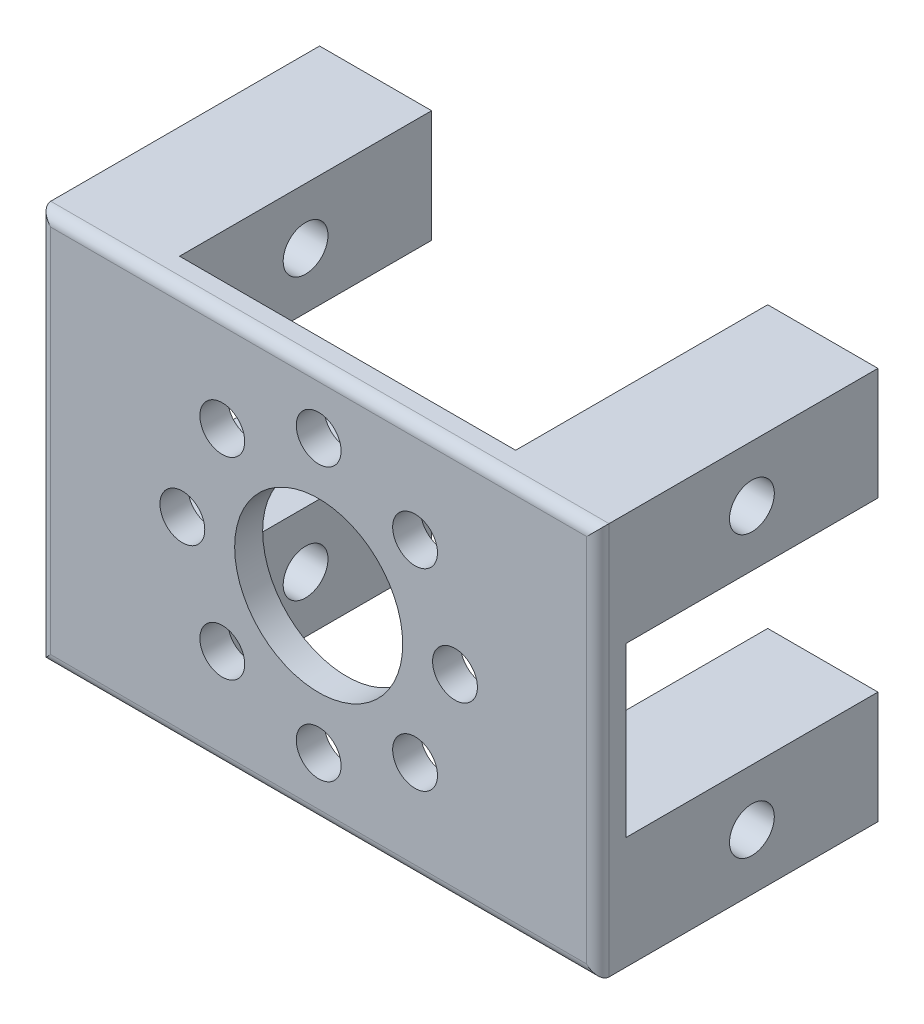
from build123d import *

# Parameters (mm, degrees)
ESBO_O1_W                  = 99.678448554
ESBO_O1_H                  = 70.090169096
ESBO_O1_R                  = 15
ESBO_O1_R_2                = 4
RESSALTO_EXTRUS_O1_DEPTH   = 50
CORTE_EXTRUS_O1_DEPTH      = 79.816915872
CORTE_EXTRUS_O1_DEPTH_BACK = 79.816915872
ESBO_O2_W                  = 60
ESBO_O2_H                  = 45
CORTE_EXTRUS_O2_DEPTH      = 79.816915872
CORTE_EXTRUS_O2_DEPTH_BACK = 79.816915872
CORTE_EXTRUS_O4_DEPTH      = 79.816915872
CORTE_EXTRUS_O4_DEPTH_BACK = 79.816915872
ESBO_O4_R                  = 4
FILETE4_R                  = 2


with BuildPart() as part:
    # Esboço1 → Ressalto-extrusão1 (new body)
    with BuildSketch(Plane.XY):
        Rectangle(ESBO_O1_W, ESBO_O1_H)
        Circle(ESBO_O1_R, mode=Mode.SUBTRACT)
        with Locations((24.33507008, 0)):
            Circle(ESBO_O1_R_2, mode=Mode.SUBTRACT)
        with Locations((17.207493074, -17.207493074)):
            Circle(ESBO_O1_R_2, mode=Mode.SUBTRACT)
        with Locations((0, -24.33507008)):
            Circle(ESBO_O1_R_2, mode=Mode.SUBTRACT)
        with Locations((-17.207493074, -17.207493074)):
            Circle(ESBO_O1_R_2, mode=Mode.SUBTRACT)
        with Locations((-24.33507008, 0)):
            Circle(ESBO_O1_R_2, mode=Mode.SUBTRACT)
        with Locations((-17.207493074, 17.207493074)):
            Circle(ESBO_O1_R_2, mode=Mode.SUBTRACT)
        with Locations((0, 24.33507008)):
            Circle(ESBO_O1_R_2, mode=Mode.SUBTRACT)
        with Locations((17.207493074, 17.207493074)):
            Circle(ESBO_O1_R_2, mode=Mode.SUBTRACT)
    extrude(amount=RESSALTO_EXTRUS_O1_DEPTH)

    # Esboço2 → Corte-extrusão1 (cut, two sides: drawn at the far end of the back side and taken through both)
    with BuildSketch(Plane(origin=(0, 0, 0), x_dir=(1, 0, 0), z_dir=(0, 1, 0)).offset(-CORTE_EXTRUS_O1_DEPTH_BACK)):
        with Locations((0.160775723, -22.5)):
            Rectangle(ESBO_O2_W, ESBO_O2_H)
    extrude(amount=CORTE_EXTRUS_O1_DEPTH + CORTE_EXTRUS_O1_DEPTH_BACK, mode=Mode.SUBTRACT)

    # Esboço3 → Corte-extrusão2 (cut, two sides: drawn at the far end of the back side and taken through both)
    with BuildSketch(Plane(origin=(0, 0, 0), x_dir=(0, 0, -1), z_dir=(1, 0, 0)).offset(-CORTE_EXTRUS_O2_DEPTH_BACK)):
        Polygon((0, 0), (0, 15), (-45, 15), (-45, -15), (0, -15), align=None)
    extrude(amount=CORTE_EXTRUS_O2_DEPTH + CORTE_EXTRUS_O2_DEPTH_BACK, mode=Mode.SUBTRACT)

    # Esboço4 → Corte-extrusão4 (cut, two sides: drawn at the far end of the back side and taken through both)
    with BuildSketch(Plane(origin=(0, 0, 0), x_dir=(0, 0, -1), z_dir=(1, 0, 0)).offset(-CORTE_EXTRUS_O4_DEPTH_BACK)):
        with Locations((-22.5, -25.022542274)):
            Circle(ESBO_O4_R)
        with Locations(Location((-22.5, 25.022542274, 0), (0, 0, 180))):
            Circle(ESBO_O4_R)
    extrude(amount=CORTE_EXTRUS_O4_DEPTH + CORTE_EXTRUS_O4_DEPTH_BACK, mode=Mode.SUBTRACT)

    # Filete4
    filete4_edges = [part.edges().sort_by_distance(p)[0] for p in [
        (-49.839224277, 0, 50),
        (0, -35.045084548, 50),
        (49.839224277, 0, 50),
        (0, 35.045084548, 50),
    ]]
    fillet(filete4_edges, radius=FILETE4_R)


solid = part.part
